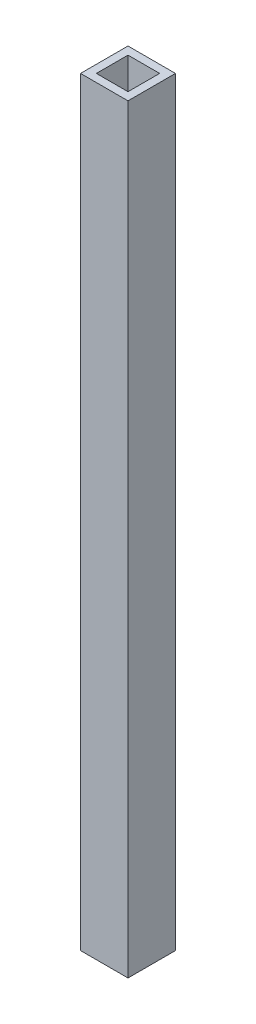
from build123d import *

# Parameters (mm, degrees)
SKETCH1_W           = 19.05
SKETCH1_H           = 19.05
BOSS_EXTRUDE1_DEPTH = 304.8
SKETCH2_W           = 12.7
SKETCH2_H           = 12.7
CUT_EXTRUDE1_DEPTH  = 406.4


with BuildPart() as part:
    # Sketch1 → Boss-Extrude1 (new body)
    with BuildSketch(Plane(origin=(0, 0, 0), x_dir=(1, 0, 0), z_dir=(0, 1, 0))):
        with Locations((9.525, 9.525)):
            Rectangle(SKETCH1_W, SKETCH1_H)
    extrude(amount=BOSS_EXTRUDE1_DEPTH)

    # Sketch2 → Cut-Extrude1 (cut)
    with BuildSketch(Plane(origin=(0, 304.8, 0), x_dir=(1, 0, 0), z_dir=(0, 1, 0))):
        with Locations((9.525, 9.525)):
            Rectangle(SKETCH2_W, SKETCH2_H)
    extrude(amount=-CUT_EXTRUDE1_DEPTH, mode=Mode.SUBTRACT)


solid = part.part
